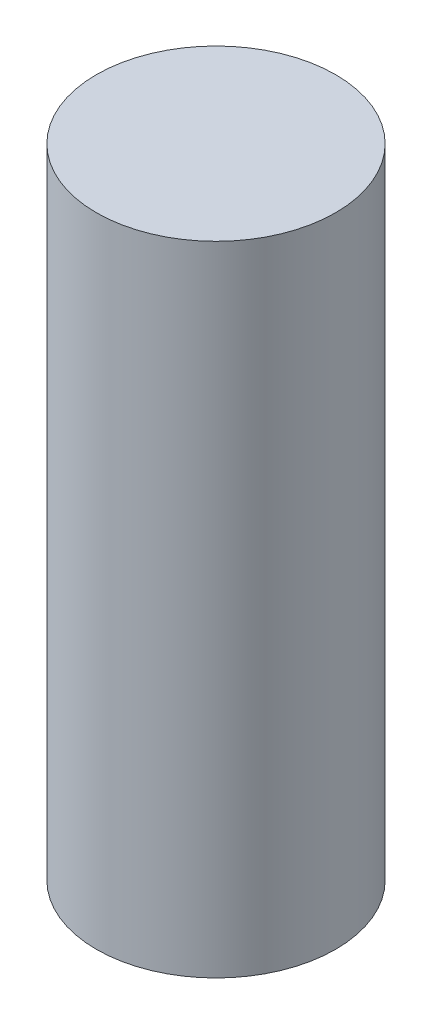
from build123d import *

# Parameters (mm, degrees)
SKETCH1_R           = 0.375
BOSS_EXTRUDE1_DEPTH = 2


with BuildPart() as part:
    # Sketch1 → Boss-Extrude1 (new body)
    with BuildSketch(Plane(origin=(0, 0, 0), x_dir=(1, 0, 0), z_dir=(0, 1, 0))):
        with Locations(Location((0, 0, 0), (0, 0, 270))):
            Circle(SKETCH1_R)
    extrude(amount=BOSS_EXTRUDE1_DEPTH)


solid = part.part
